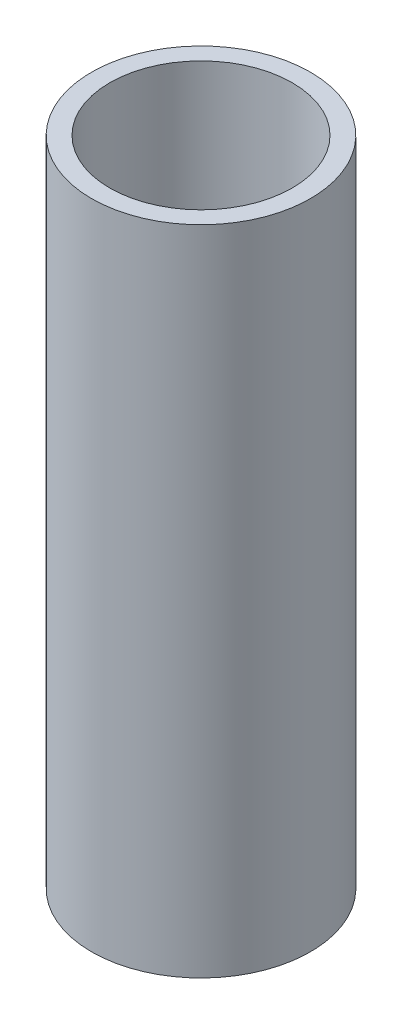
from build123d import *

# Parameters (mm, degrees)
SZKIC1_R                    = 12
SZKIC1_R_2                  = 10
DODANIE_WYCI_GNI_CIE1_DEPTH = 71.5


with BuildPart() as part:
    # Szkic1 → Dodanie-wyciągnięcie1 (new body)
    with BuildSketch(Plane(origin=(0, 0, 0), x_dir=(1, 0, 0), z_dir=(0, 1, 0))):
        with Locations(Location((0, 0, 0), (0, 0, 270))):
            Circle(SZKIC1_R)
        with Locations(Location((0, 0, 0), (0, 0, 270))):
            Circle(SZKIC1_R_2, mode=Mode.SUBTRACT)
    extrude(amount=DODANIE_WYCI_GNI_CIE1_DEPTH)


solid = part.part
